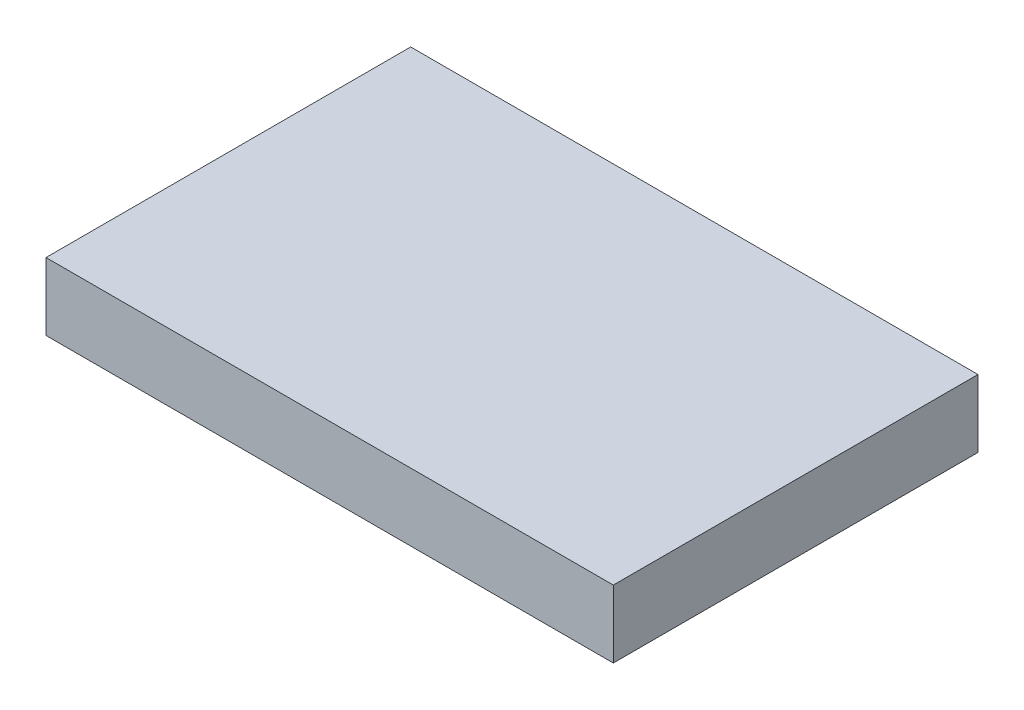
from build123d import *

# Parameters (mm, degrees)
SKETCH1_W           = 84
SKETCH1_H           = 54
BOSS_EXTRUDE1_DEPTH = 10


with BuildPart() as part:
    # Sketch1 → Boss-Extrude1 (new body)
    with BuildSketch(Plane(origin=(0, 0, 0), x_dir=(1, 0, 0), z_dir=(0, 1, 0))):
        Rectangle(SKETCH1_W, SKETCH1_H)
    extrude(amount=BOSS_EXTRUDE1_DEPTH)


solid = part.part
